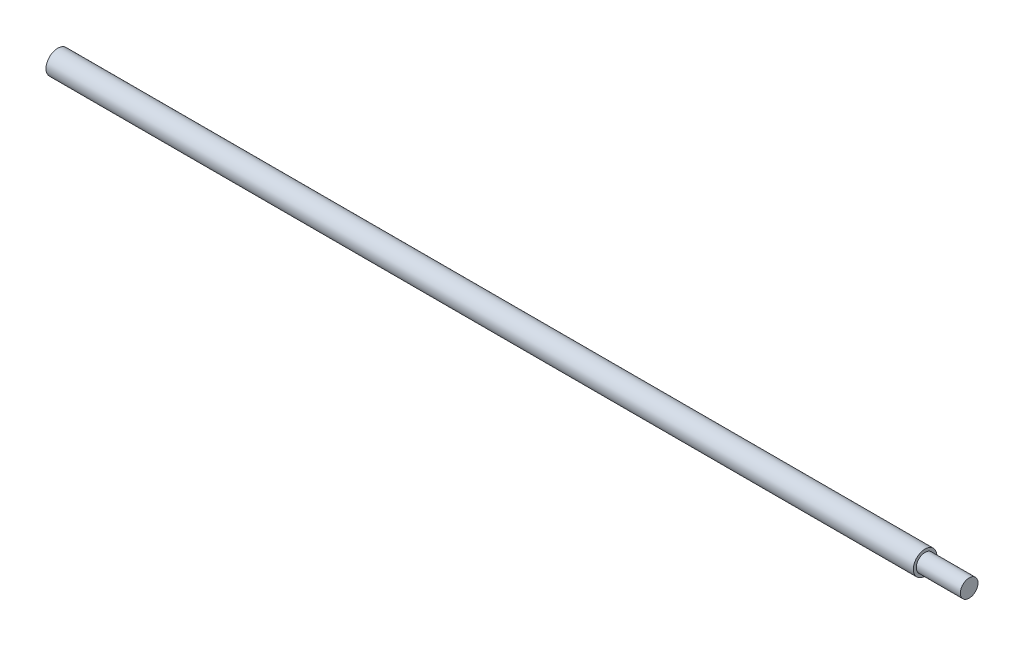
from build123d import *


with BuildPart() as part:
    # Sketch1 → Revolve1 (revolve)
    with BuildSketch(Plane.XY, mode=Mode.PRIVATE) as revolve1_sk:
        Polygon((-155, 0), (-155, 4), (140, 4), (140, 3), (155, 3), (155, 0), align=None)
    revolve(revolve1_sk.sketch.rotate(Axis((277.081919691, 0, 0), (-1, 0, 0)), 90), axis=Axis((277.081919691, 0, 0), (-1, 0, 0)))


solid = part.part
